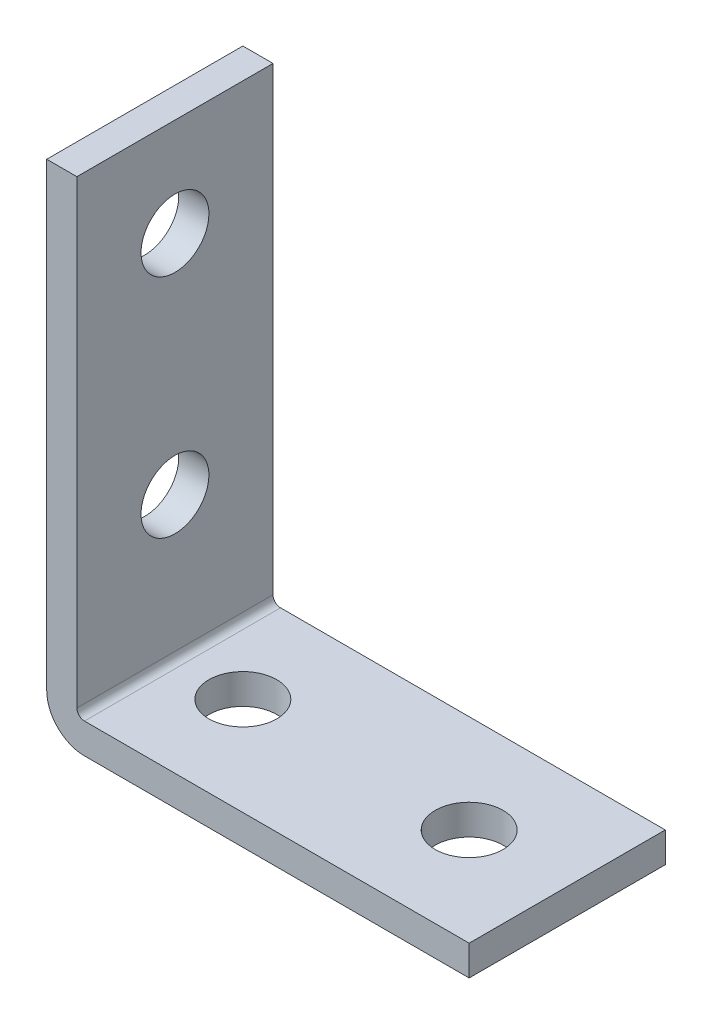
from build123d import *

# Parameters (mm, degrees)
EXTRUDE_THIN1_DEPTH = 20.6375
SKETCH2_R           = 7.14375
CUT_EXTRUDE1_DEPTH  = 135.225917882
SKETCH3_R           = 7.14375
CUT_EXTRUDE2_DEPTH  = 135.974847773


with BuildPart() as part:
    # Sketch1 → Extrude-Thin1 (new, symmetric)
    with BuildSketch(Plane.XY):
        with BuildLine():
            Line((0, 104.775), (0, 7.9375))
            ThreePointArc((0, 7.9375), (2.324839924, 2.324839924), (7.9375, 0))
            Line((7.9375, 0), (88.9, 0))
            Line((88.9, 0), (88.9, 6.35))
            Line((88.9, 6.35), (7.9375, 6.35))
            ThreePointArc((7.9375, 6.35), (6.814967985, 6.814967985), (6.35, 7.9375))
            Line((6.35, 7.9375), (6.35, 104.775))
            Line((6.35, 104.775), (0, 104.775))
        make_face()
    extrude(amount=EXTRUDE_THIN1_DEPTH, both=True)

    # Sketch2 → Cut-Extrude1 (cut, through all)
    with BuildSketch(Plane(origin=(0, 6.35, 0), x_dir=(1, 0, 0), z_dir=(0, 1, 0))):
        with Locations(Location((68.2625, 0, 0), (0, 0, 270))):
            Circle(SKETCH2_R)
        with Locations(Location((20.6375, 0, 0), (0, 0, 270))):
            Circle(SKETCH2_R)
    extrude(amount=-CUT_EXTRUDE1_DEPTH, mode=Mode.SUBTRACT)

    # Sketch3 → Cut-Extrude2 (cut, through all)
    with BuildSketch(Plane(origin=(6.35, 0, 0), x_dir=(0, 0, -1), z_dir=(1, 0, 0))):
        with Locations(Location((0, 84.1375, 0), (0, 0, 90))):
            Circle(SKETCH3_R)
        with Locations(Location((0, 36.5125, 0), (0, 0, 90))):
            Circle(SKETCH3_R)
    extrude(amount=-CUT_EXTRUDE2_DEPTH, mode=Mode.SUBTRACT)


solid = part.part
